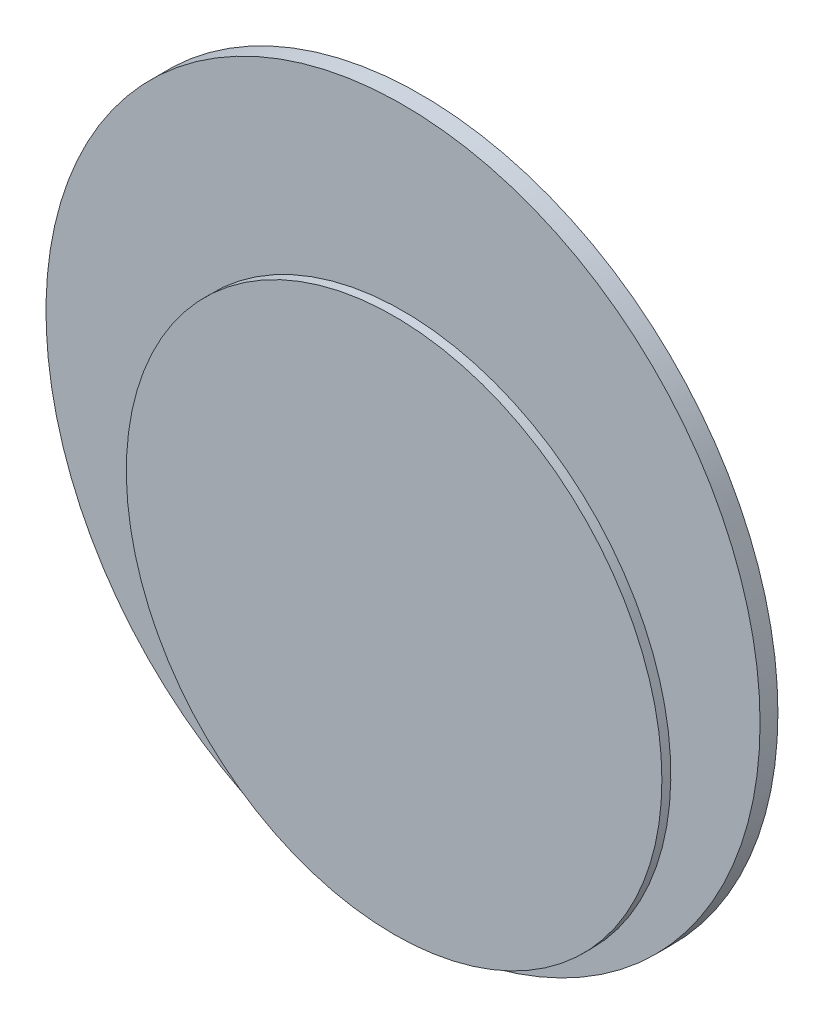
from build123d import *

# Parameters (mm, degrees)
SKETCH1_R           = 20
BOSS_EXTRUDE1_DEPTH = 1
SKETCH1_3_R         = 15
BOSS_EXTRUDE2_DEPTH = 0.5


with BuildPart() as part:
    # Sketch1 → Boss-Extrude1 (new body)
    with BuildSketch(Plane.XY):
        Circle(SKETCH1_R)
    extrude(amount=-BOSS_EXTRUDE1_DEPTH)

    # Sketch1<3> → Boss-Extrude2 (add)
    with BuildSketch(Plane.XY):
        with Locations((0, -5)):
            Circle(SKETCH1_3_R)
    extrude(amount=BOSS_EXTRUDE2_DEPTH)


solid = part.part
